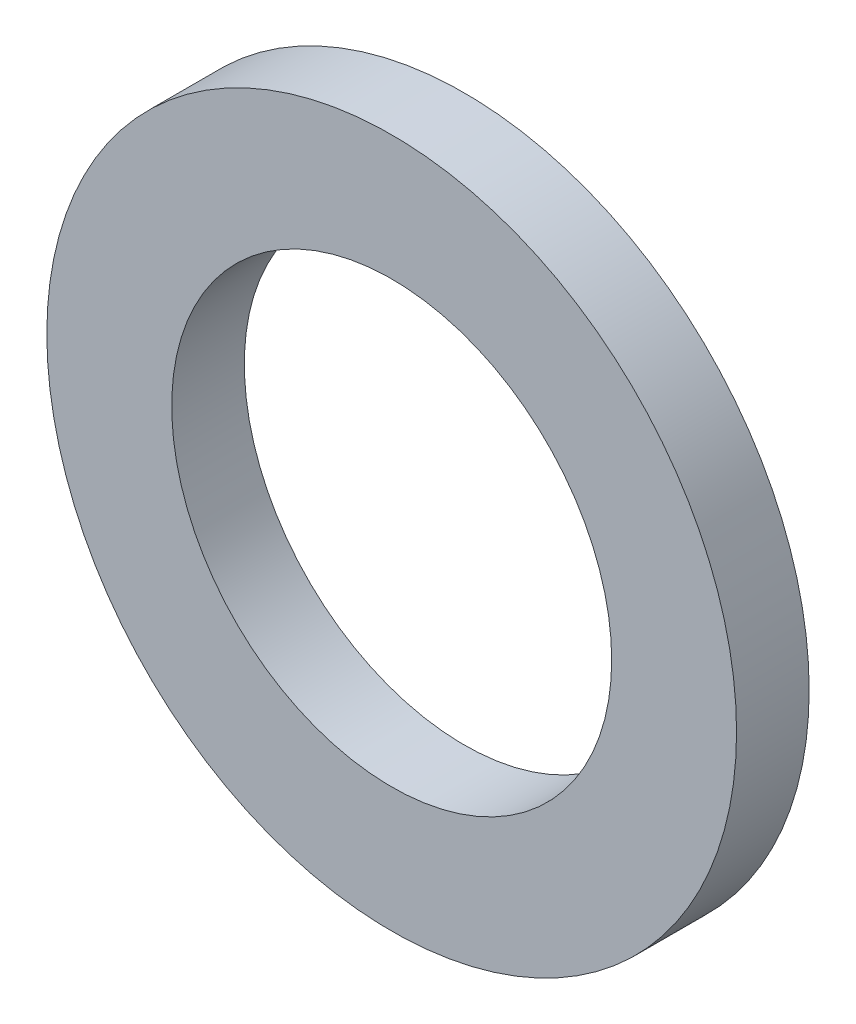
from build123d import *

# Parameters (mm, degrees)
SCHIZZO1_R                   = 4.75
SCHIZZO1_R_2                 = 3.03
ESTRUSIONE_ESTRUSIONE1_DEPTH = 1


with BuildPart() as part:
    # Schizzo1 → Estrusione-Estrusione1 (new body)
    with BuildSketch(Plane.XY):
        Circle(SCHIZZO1_R)
        Circle(SCHIZZO1_R_2, mode=Mode.SUBTRACT)
    extrude(amount=ESTRUSIONE_ESTRUSIONE1_DEPTH)


solid = part.part
